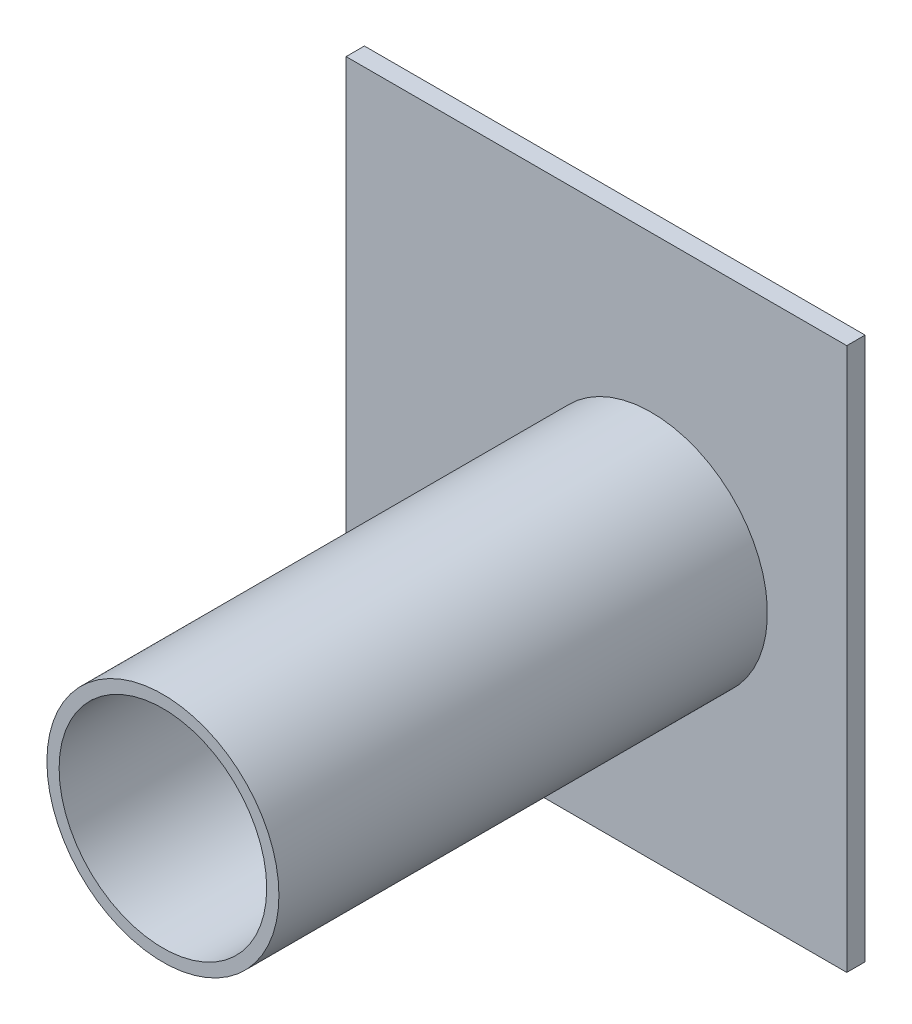
from build123d import *

# Parameters (mm, degrees)
BASE_R              = 17
BOSS_EXTRUDE1_DEPTH = 3
SKETCH1_R           = 19
SKETCH1_R_2         = 17
BOSS_EXTRUDE2_DEPTH = 80


with BuildPart() as part:
    # Base → Boss-Extrude1 (new body)
    with BuildSketch(Plane.XY):
        Polygon((-50, -44.45), (0, -44.45), (32, -44.45), (32, 44.45), (-50, 44.45), align=None)
        Circle(BASE_R, mode=Mode.SUBTRACT)
    extrude(amount=BOSS_EXTRUDE1_DEPTH)

    # Sketch1 → Boss-Extrude2 (add)
    with BuildSketch(Plane.XY.offset(3)):
        with Locations(Location((0, 0, 0), (0, 0, 180))):
            Circle(SKETCH1_R)
        Circle(SKETCH1_R_2, mode=Mode.SUBTRACT)
    extrude(amount=BOSS_EXTRUDE2_DEPTH)


solid = part.part
